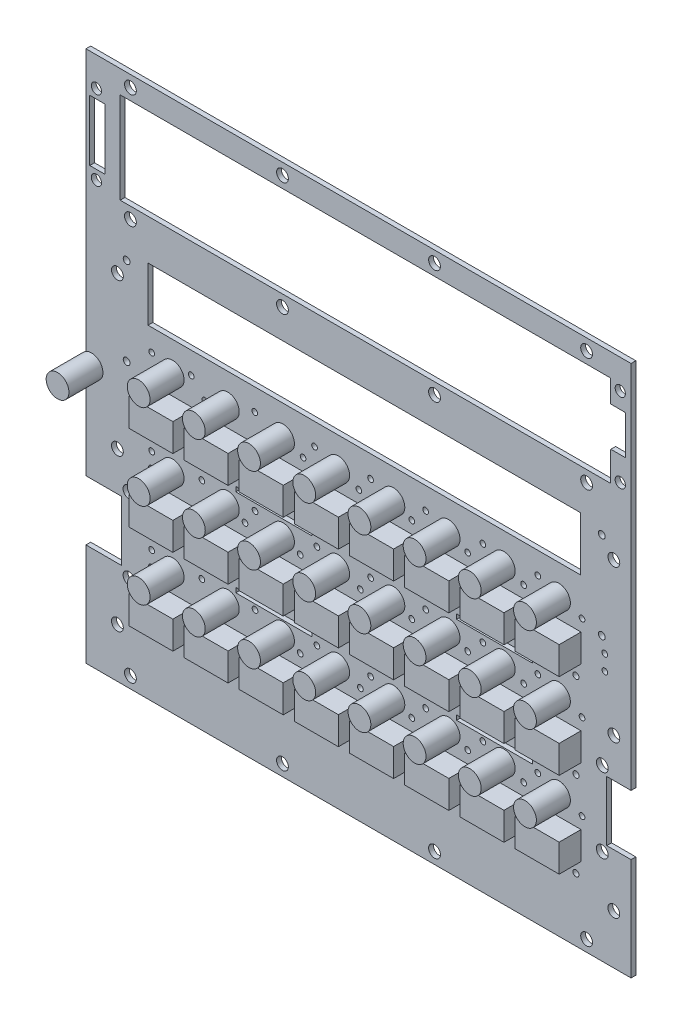
from build123d import *

# Parameters (mm, degrees)
SKETCH1_W                       = 144.56156
SKETCH1_H                       = 18.00098
SKETCH1_W_2                     = 5.08
SKETCH1_H_2                     = 20.32
SKETCH1_W_3                     = 25.4
SKETCH1_H_3                     = 1.5875
BOARD_DEPTH                     = 1.592072
SKETCH2_R                       = 3.81
LED_KINGBRIGHT_3P_2P54_1_DEPTH  = 11.3538
SKETCH3_R                       = 3.81
LED_KINGBRIGHT_3P_2P54_2_DEPTH  = 11.3538
SKETCH4_R                       = 3.81
LED_KINGBRIGHT_3P_2P54_3_DEPTH  = 11.3538
SKETCH5_R                       = 3.81
LED_KINGBRIGHT_3P_2P54_4_DEPTH  = 11.3538
SKETCH6_R                       = 3.81
LED_KINGBRIGHT_3P_2P54_5_DEPTH  = 11.3538
SKETCH7_R                       = 3.81
LED_KINGBRIGHT_3P_2P54_6_DEPTH  = 11.3538
SKETCH8_R                       = 3.81
LED_KINGBRIGHT_3P_2P54_7_DEPTH  = 11.3538
SKETCH9_R                       = 3.81
LED_KINGBRIGHT_3P_2P54_8_DEPTH  = 11.3538
SKETCH10_R                      = 3.81
LED_KINGBRIGHT_3P_2P54_9_DEPTH  = 11.3538
SKETCH11_R                      = 3.81
LED_KINGBRIGHT_3P_2P54_10_DEPTH = 11.3538
SKETCH12_R                      = 3.81
LED_KINGBRIGHT_3P_2P54_11_DEPTH = 11.3538
SKETCH13_R                      = 3.81
LED_KINGBRIGHT_3P_2P54_12_DEPTH = 11.3538
SKETCH14_R                      = 3.81
LED_KINGBRIGHT_3P_2P54_13_DEPTH = 11.3538
SKETCH15_R                      = 3.81
LED_KINGBRIGHT_3P_2P54_14_DEPTH = 11.3538
SKETCH16_R                      = 3.81
LED_KINGBRIGHT_3P_2P54_15_DEPTH = 11.3538
SKETCH17_R                      = 3.81
LED_KINGBRIGHT_3P_2P54_16_DEPTH = 11.3538
SKETCH18_R                      = 3.81
LED_KINGBRIGHT_3P_2P54_17_DEPTH = 11.3538
SKETCH19_R                      = 3.81
LED_KINGBRIGHT_3P_2P54_18_DEPTH = 11.3538
SKETCH20_R                      = 3.81
LED_KINGBRIGHT_3P_2P54_19_DEPTH = 11.3538
SKETCH21_R                      = 3.81
LED_KINGBRIGHT_3P_2P54_20_DEPTH = 11.3538
SKETCH22_R                      = 3.81
LED_KINGBRIGHT_3P_2P54_21_DEPTH = 11.3538
SKETCH23_R                      = 3.81
LED_KINGBRIGHT_3P_2P54_22_DEPTH = 11.3538
SKETCH24_R                      = 3.81
LED_KINGBRIGHT_3P_2P54_23_DEPTH = 11.3538
SKETCH25_R                      = 3.81
LED_KINGBRIGHT_3P_2P54_24_DEPTH = 11.3538
SKETCH26_R                      = 3.81
LED_KINGBRIGHT_3P_2P54_25_DEPTH = 11.3538
SKETCH27_W                      = 14.732
SKETCH27_H                      = 9.271
SWITCH_MCDTS2_1_DEPTH           = 7.3000108
SKETCH28_W                      = 14.732
SKETCH28_H                      = 9.271
SWITCH_MCDTS2_2_DEPTH           = 7.3000108
SKETCH29_W                      = 14.732
SKETCH29_H                      = 9.271
SWITCH_MCDTS2_3_DEPTH           = 7.3000108
SKETCH30_W                      = 14.732
SKETCH30_H                      = 9.271
SWITCH_MCDTS2_4_DEPTH           = 7.3000108
SKETCH31_W                      = 14.732
SKETCH31_H                      = 9.271
SWITCH_MCDTS2_5_DEPTH           = 7.3000108
SKETCH32_W                      = 14.732
SKETCH32_H                      = 9.271
SWITCH_MCDTS2_6_DEPTH           = 7.3000108
SKETCH33_W                      = 14.732
SKETCH33_H                      = 9.271
SWITCH_MCDTS2_7_DEPTH           = 7.3000108
SKETCH34_W                      = 14.732
SKETCH34_H                      = 9.271
SWITCH_MCDTS2_8_DEPTH           = 7.3000108
SKETCH35_W                      = 14.732
SKETCH35_H                      = 9.271
SWITCH_MCDTS2_9_DEPTH           = 7.3000108
SKETCH36_W                      = 14.732
SKETCH36_H                      = 9.271
SWITCH_MCDTS2_10_DEPTH          = 7.3000108
SKETCH37_W                      = 14.732
SKETCH37_H                      = 9.271
SWITCH_MCDTS2_11_DEPTH          = 7.3000108
SKETCH38_W                      = 14.732
SKETCH38_H                      = 9.271
SWITCH_MCDTS2_12_DEPTH          = 7.3000108
SKETCH39_W                      = 14.732
SKETCH39_H                      = 9.271
SWITCH_MCDTS2_13_DEPTH          = 7.3000108
SKETCH40_W                      = 14.732
SKETCH40_H                      = 9.271
SWITCH_MCDTS2_14_DEPTH          = 7.3000108
SKETCH41_W                      = 14.732
SKETCH41_H                      = 9.271
SWITCH_MCDTS2_15_DEPTH          = 7.3000108
SKETCH42_W                      = 14.732
SKETCH42_H                      = 9.271
SWITCH_MCDTS2_16_DEPTH          = 7.3000108
SKETCH43_W                      = 14.732
SKETCH43_H                      = 9.271
SWITCH_MCDTS2_17_DEPTH          = 7.3000108
SKETCH44_W                      = 14.732
SKETCH44_H                      = 9.271
SWITCH_MCDTS2_18_DEPTH          = 7.3000108
SKETCH45_W                      = 14.732
SKETCH45_H                      = 9.271
SWITCH_MCDTS2_19_DEPTH          = 7.3000108
SKETCH46_W                      = 14.732
SKETCH46_H                      = 9.271
SWITCH_MCDTS2_20_DEPTH          = 7.3000108
SKETCH47_W                      = 14.732
SKETCH47_H                      = 9.271
SWITCH_MCDTS2_21_DEPTH          = 7.3000108
SKETCH48_W                      = 14.732
SKETCH48_H                      = 9.271
SWITCH_MCDTS2_22_DEPTH          = 7.3000108
SKETCH49_W                      = 14.732
SKETCH49_H                      = 9.271
SWITCH_MCDTS2_23_DEPTH          = 7.3000108
SKETCH50_W                      = 14.732
SKETCH50_H                      = 9.271
SWITCH_MCDTS2_24_DEPTH          = 7.3000108
SKETCH56_R                      = 1.016
SKETCH56_R_2                    = 0.9652
SKETCH56_R_3                    = 0.9525
SKETCH56_R_4                    = 1.9685
SKETCH56_R_5                    = 1.1303
SKETCH56_R_6                    = 1.7145
CUT_EXTRUDE1_DEPTH              = 10


with BuildPart() as part:
    # Sketch1 → BOARD (new body)
    with BuildSketch(Plane.XY):
        Polygon((0, 0), (182.118, 0), (182.118, 34.24682), (173.98746, 34.24682), (173.98746, 54.24678), (182.118, 54.24678), (182.118, 177.8), (0, 177.8), (0, 54.24678), (11.86942, 54.24678), (11.86942, 34.24682), (0, 34.24682), align=None)
        with Locations((93.01988, 117.17909)):
            Rectangle(SKETCH1_W, SKETCH1_H, mode=Mode.SUBTRACT)
        with Locations((3.81, 154.813)):
            Rectangle(SKETCH1_W_2, SKETCH1_H_2, mode=Mode.SUBTRACT)
        Polygon((12.7, 170.18), (175.26, 170.18), (175.26, 162.6616), (180.086, 162.6616), (180.2892, 162.4584), (180.2892, 149.606), (175.3616, 149.606), (175.26, 149.5044), (175.26, 139.7), (12.7, 139.7), (11.43, 139.7), (11.43, 170.18), align=None, mode=Mode.SUBTRACT)
        with Locations((62.7634, 46.20895)):
            Rectangle(SKETCH1_W_3, SKETCH1_H_3, mode=Mode.SUBTRACT)
        with Locations((136.5134176, 46.20895)):
            Rectangle(SKETCH1_W_3, SKETCH1_H_3, mode=Mode.SUBTRACT)
        with Locations((136.5134176, 75.41895)):
            Rectangle(SKETCH1_W_3, SKETCH1_H_3, mode=Mode.SUBTRACT)
        with Locations((62.7634, 75.41895)):
            Rectangle(SKETCH1_W_3, SKETCH1_H_3, mode=Mode.SUBTRACT)
    extrude(amount=BOARD_DEPTH)

    # Sketch56 → Cut-Extrude1 (cut)
    with BuildSketch(Plane.XY.offset(1.592072)):
        with Locations((163.703, 21.1074)):
            Circle(SKETCH56_R)
        with Locations((163.703, 49.6824)):
            Circle(SKETCH56_R)
        with Locations((145.2626, 21.8186)):
            Circle(SKETCH56_R_2)
        with Locations((126.8476, 21.6154)):
            Circle(SKETCH56_R_2)
        with Locations((108.4072, 21.7424)):
            Circle(SKETCH56_R_2)
        with Locations((89.9668, 21.844)):
            Circle(SKETCH56_R_2)
        with Locations((71.5264, 20.7772)):
            Circle(SKETCH56_R_2)
        with Locations((53.086, 21.1582)):
            Circle(SKETCH56_R_2)
        with Locations((34.6472002, 21.1328)):
            Circle(SKETCH56_R)
        with Locations((145.2626, 49.5554)):
            Circle(SKETCH56_R)
        with Locations((126.8222, 49.3522)):
            Circle(SKETCH56_R)
        with Locations((108.3818, 49.1236)):
            Circle(SKETCH56_R)
        with Locations((89.9414, 49.6824)):
            Circle(SKETCH56_R)
        with Locations((71.501, 49.1998)):
            Circle(SKETCH56_R)
        with Locations((53.0606, 49.1998)):
            Circle(SKETCH56_R)
        with Locations((34.6202, 49.276)):
            Circle(SKETCH56_R)
        with Locations((163.703, 78.2574)):
            Circle(SKETCH56_R)
        with Locations((145.2626, 77.7748)):
            Circle(SKETCH56_R)
        with Locations((126.746, 78.3336)):
            Circle(SKETCH56_R)
        with Locations((108.3818, 78.74)):
            Circle(SKETCH56_R)
        with Locations((89.9414, 78.3336)):
            Circle(SKETCH56_R)
        with Locations((71.501, 78.2574)):
            Circle(SKETCH56_R)
        with Locations((53.0606, 78.4098)):
            Circle(SKETCH56_R)
        with Locations((34.6202, 78.0542)):
            Circle(SKETCH56_R)
        with Locations((91.694, 38.6588)):
            Circle(SKETCH56_R_3)
        with Locations((77.1652, 43.7388)):
            Circle(SKETCH56_R_3)
        with Locations((71.5772, 38.6588)):
            Circle(SKETCH56_R_3)
        with Locations((56.4896, 43.7388)):
            Circle(SKETCH56_R_3)
        with Locations((38.735, 43.7388)):
            Circle(SKETCH56_R_3)
        with Locations((21.8948, 38.6588)):
            Circle(SKETCH56_R_3)
        with Locations((21.971, 43.7388)):
            Circle(SKETCH56_R_3)
        with Locations((77.1652, 72.3138)):
            Circle(SKETCH56_R_3)
        with Locations((91.694, 67.2338)):
            Circle(SKETCH56_R_3)
        with Locations((71.5772, 67.2338)):
            Circle(SKETCH56_R_3)
        with Locations((56.4896, 72.3138)):
            Circle(SKETCH56_R_3)
        with Locations((53.1368, 67.2338)):
            Circle(SKETCH56_R_3)
        with Locations((38.735, 72.3138)):
            Circle(SKETCH56_R_3)
        with Locations((21.8948, 67.2338)):
            Circle(SKETCH56_R_3)
        with Locations((21.971, 72.3138)):
            Circle(SKETCH56_R_3)
        with Locations((165.735, 95.8088)):
            Circle(SKETCH56_R_3)
        with Locations((150.9776, 100.8888)):
            Circle(SKETCH56_R_3)
        with Locations((146.2278, 95.8088)):
            Circle(SKETCH56_R_3)
        with Locations((132.6134, 100.8888)):
            Circle(SKETCH56_R_3)
        with Locations((113.4872, 100.8888)):
            Circle(SKETCH56_R_3)
        with Locations((127.508, 95.8088)):
            Circle(SKETCH56_R_3)
        with Locations((108.8644, 95.8088)):
            Circle(SKETCH56_R_3)
        with Locations((95.0976, 100.8888)):
            Circle(SKETCH56_R_3)
        with Locations((91.186, 95.8088)):
            Circle(SKETCH56_R_3)
        with Locations((76.3778, 100.8888)):
            Circle(SKETCH56_R_3)
        with Locations((72.5424, 95.8088)):
            Circle(SKETCH56_R_3)
        with Locations((56.4134, 100.8888)):
            Circle(SKETCH56_R_3)
        with Locations((39.7256, 95.8088)):
            Circle(SKETCH56_R_3)
        with Locations((35.179, 100.8888)):
            Circle(SKETCH56_R_3)
        with Locations((24.2062, 95.8088)):
            Circle(SKETCH56_R_3)
        with Locations((21.971, 100.8888)):
            Circle(SKETCH56_R_3)
        with Locations((132.6134, 72.3138)):
            Circle(SKETCH56_R_3)
        with Locations((146.2278, 67.2338)):
            Circle(SKETCH56_R_3)
        with Locations((113.4872, 72.3138)):
            Circle(SKETCH56_R_3)
        with Locations((127.508, 67.2338)):
            Circle(SKETCH56_R_3)
        with Locations((95.0976, 72.3138)):
            Circle(SKETCH56_R_3)
        with Locations((108.8644, 67.2338)):
            Circle(SKETCH56_R_3)
        with Locations((150.9776, 43.7388)):
            Circle(SKETCH56_R_3)
        with Locations((132.6134, 43.7388)):
            Circle(SKETCH56_R_3)
        with Locations((113.4872, 43.7388)):
            Circle(SKETCH56_R_3)
        with Locations((95.0976, 43.7388)):
            Circle(SKETCH56_R_3)
        with Locations((108.8644, 38.6588)):
            Circle(SKETCH56_R_3)
        with Locations((150.9776, 72.3138)):
            Circle(SKETCH56_R_3)
        with Locations((165.735, 67.2338)):
            Circle(SKETCH56_R_3)
        with Locations((173.3296, 89.4588)):
            Circle(SKETCH56_R_3)
        with Locations((173.355, 84.3534)):
            Circle(SKETCH56_R_3)
        with Locations((176.37252, 118.11)):
            Circle(SKETCH56_R_4)
        with Locations((176.37252, 67.31)):
            Circle(SKETCH56_R_4)
        with Locations((176.37252, 16.51)):
            Circle(SKETCH56_R_4)
        with Locations((167.259, 135.89)):
            Circle(SKETCH56_R_4)
        with Locations((116.459, 135.89)):
            Circle(SKETCH56_R_4)
        with Locations((65.659, 135.89)):
            Circle(SKETCH56_R_4)
        with Locations((14.859, 135.89)):
            Circle(SKETCH56_R_4)
        with Locations((10.51052, 118.11)):
            Circle(SKETCH56_R_4)
        with Locations((10.51052, 67.31)):
            Circle(SKETCH56_R_4)
        with Locations((10.51052, 16.51)):
            Circle(SKETCH56_R_4)
        with Locations((165.735, 38.6588)):
            Circle(SKETCH56_R_3)
        with Locations((146.2278, 38.6588)):
            Circle(SKETCH56_R_3)
        with Locations((127.508, 38.6588)):
            Circle(SKETCH56_R_3)
        with Locations((14.859, 173.99)):
            Circle(SKETCH56_R_4)
        with Locations((65.659, 173.99)):
            Circle(SKETCH56_R_4)
        with Locations((116.459, 173.99)):
            Circle(SKETCH56_R_4)
        with Locations((167.259, 173.99)):
            Circle(SKETCH56_R_4)
        with Locations((167.259, 3.81)):
            Circle(SKETCH56_R_4)
        with Locations((116.459, 3.81)):
            Circle(SKETCH56_R_4)
        with Locations((65.659, 3.81)):
            Circle(SKETCH56_R_4)
        with Locations((14.859, 3.81)):
            Circle(SKETCH56_R_4)
        with Locations((172.50664, 56.7436)):
            Circle(SKETCH56_R_4)
        with Locations((172.50664, 31.75)):
            Circle(SKETCH56_R_4)
        with Locations((14.36878, 56.7436)):
            Circle(SKETCH56_R_4)
        with Locations((14.36878, 31.75)):
            Circle(SKETCH56_R_4)
        with Locations((172.34154, 123.37542)):
            Circle(SKETCH56_R_5)
        with Locations((172.34154, 94.16542)):
            Circle(SKETCH56_R_5)
        with Locations((13.59154, 94.16542)):
            Circle(SKETCH56_R_5)
        with Locations((13.59154, 123.37542)):
            Circle(SKETCH56_R_5)
        with Locations((178.51374, 141.56182)):
            Circle(SKETCH56_R_6)
        with Locations((178.51374, 168.06164)):
            Circle(SKETCH56_R_6)
        with Locations((3.50012, 168.06164)):
            Circle(SKETCH56_R_6)
        with Locations((3.50012, 141.56182)):
            Circle(SKETCH56_R_6)
    extrude(amount=-CUT_EXTRUDE1_DEPTH, mode=Mode.SUBTRACT)


with BuildPart() as body_2:
    # Sketch2 → LED-KINGBRIGHT_3P_2P54-1 (new body)
    with BuildSketch(Plane.XY.offset(1.592072)):
        with Locations((1.86944, 86.9188)):
            Circle(SKETCH2_R)
    extrude(amount=LED_KINGBRIGHT_3P_2P54_1_DEPTH)


with BuildPart() as body_3:
    # Sketch3 → LED-KINGBRIGHT_3P_2P54-2 (new body)
    with BuildSketch(Plane.XY.offset(1.592072)):
        with Locations((158.0312054, 41.1988)):
            Circle(SKETCH3_R)
    extrude(amount=LED_KINGBRIGHT_3P_2P54_2_DEPTH)


with BuildPart() as body_4:
    # Sketch4 → LED-KINGBRIGHT_3P_2P54-3 (new body)
    with BuildSketch(Plane.XY.offset(1.592072)):
        with Locations((139.593701, 41.1988)):
            Circle(SKETCH4_R)
    extrude(amount=LED_KINGBRIGHT_3P_2P54_3_DEPTH)


with BuildPart() as body_5:
    # Sketch5 → LED-KINGBRIGHT_3P_2P54-4 (new body)
    with BuildSketch(Plane.XY.offset(1.592072)):
        with Locations((121.1561966, 41.1988)):
            Circle(SKETCH5_R)
    extrude(amount=LED_KINGBRIGHT_3P_2P54_4_DEPTH)


with BuildPart() as body_6:
    # Sketch6 → LED-KINGBRIGHT_3P_2P54-5 (new body)
    with BuildSketch(Plane.XY.offset(1.592072)):
        with Locations((102.7187176, 41.1988)):
            Circle(SKETCH6_R)
    extrude(amount=LED_KINGBRIGHT_3P_2P54_5_DEPTH)


with BuildPart() as body_7:
    # Sketch7 → LED-KINGBRIGHT_3P_2P54-6 (new body)
    with BuildSketch(Plane.XY.offset(1.592072)):
        with Locations((158.0312308, 69.7738)):
            Circle(SKETCH7_R)
    extrude(amount=LED_KINGBRIGHT_3P_2P54_6_DEPTH)


with BuildPart() as body_8:
    # Sketch8 → LED-KINGBRIGHT_3P_2P54-7 (new body)
    with BuildSketch(Plane.XY.offset(1.592072)):
        with Locations((139.5937264, 69.7738)):
            Circle(SKETCH8_R)
    extrude(amount=LED_KINGBRIGHT_3P_2P54_7_DEPTH)


with BuildPart() as body_9:
    # Sketch9 → LED-KINGBRIGHT_3P_2P54-8 (new body)
    with BuildSketch(Plane.XY.offset(1.592072)):
        with Locations((121.156222, 69.7738)):
            Circle(SKETCH9_R)
    extrude(amount=LED_KINGBRIGHT_3P_2P54_8_DEPTH)


with BuildPart() as body_10:
    # Sketch10 → LED-KINGBRIGHT_3P_2P54-9 (new body)
    with BuildSketch(Plane.XY.offset(1.592072)):
        with Locations((102.7187176, 69.7738)):
            Circle(SKETCH10_R)
    extrude(amount=LED_KINGBRIGHT_3P_2P54_9_DEPTH)


with BuildPart() as body_11:
    # Sketch11 → LED-KINGBRIGHT_3P_2P54-10 (new body)
    with BuildSketch(Plane.XY.offset(1.592072)):
        with Locations((84.2812132, 41.1988)):
            Circle(SKETCH11_R)
    extrude(amount=LED_KINGBRIGHT_3P_2P54_10_DEPTH)


with BuildPart() as body_12:
    # Sketch12 → LED-KINGBRIGHT_3P_2P54-11 (new body)
    with BuildSketch(Plane.XY.offset(1.592072)):
        with Locations((65.8437088, 41.1988)):
            Circle(SKETCH12_R)
    extrude(amount=LED_KINGBRIGHT_3P_2P54_11_DEPTH)


with BuildPart() as body_13:
    # Sketch13 → LED-KINGBRIGHT_3P_2P54-12 (new body)
    with BuildSketch(Plane.XY.offset(1.592072)):
        with Locations((47.4062044, 41.1988)):
            Circle(SKETCH13_R)
    extrude(amount=LED_KINGBRIGHT_3P_2P54_12_DEPTH)


with BuildPart() as body_14:
    # Sketch14 → LED-KINGBRIGHT_3P_2P54-13 (new body)
    with BuildSketch(Plane.XY.offset(1.592072)):
        with Locations((28.9687, 41.1988)):
            Circle(SKETCH14_R)
    extrude(amount=LED_KINGBRIGHT_3P_2P54_13_DEPTH)


with BuildPart() as body_15:
    # Sketch15 → LED-KINGBRIGHT_3P_2P54-14 (new body)
    with BuildSketch(Plane.XY.offset(1.592072)):
        with Locations((84.2812132, 69.7738)):
            Circle(SKETCH15_R)
    extrude(amount=LED_KINGBRIGHT_3P_2P54_14_DEPTH)


with BuildPart() as body_16:
    # Sketch16 → LED-KINGBRIGHT_3P_2P54-15 (new body)
    with BuildSketch(Plane.XY.offset(1.592072)):
        with Locations((65.8437088, 69.7738)):
            Circle(SKETCH16_R)
    extrude(amount=LED_KINGBRIGHT_3P_2P54_15_DEPTH)


with BuildPart() as body_17:
    # Sketch17 → LED-KINGBRIGHT_3P_2P54-16 (new body)
    with BuildSketch(Plane.XY.offset(1.592072)):
        with Locations((47.4062044, 69.7738)):
            Circle(SKETCH17_R)
    extrude(amount=LED_KINGBRIGHT_3P_2P54_16_DEPTH)


with BuildPart() as body_18:
    # Sketch18 → LED-KINGBRIGHT_3P_2P54-17 (new body)
    with BuildSketch(Plane.XY.offset(1.592072)):
        with Locations((28.9687, 69.7738)):
            Circle(SKETCH18_R)
    extrude(amount=LED_KINGBRIGHT_3P_2P54_17_DEPTH)


with BuildPart() as body_19:
    # Sketch19 → LED-KINGBRIGHT_3P_2P54-18 (new body)
    with BuildSketch(Plane.XY.offset(1.592072)):
        with Locations((158.0312308, 98.3488)):
            Circle(SKETCH19_R)
    extrude(amount=LED_KINGBRIGHT_3P_2P54_18_DEPTH)


with BuildPart() as body_20:
    # Sketch20 → LED-KINGBRIGHT_3P_2P54-19 (new body)
    with BuildSketch(Plane.XY.offset(1.592072)):
        with Locations((139.5937264, 98.3488)):
            Circle(SKETCH20_R)
    extrude(amount=LED_KINGBRIGHT_3P_2P54_19_DEPTH)


with BuildPart() as body_21:
    # Sketch21 → LED-KINGBRIGHT_3P_2P54-20 (new body)
    with BuildSketch(Plane.XY.offset(1.592072)):
        with Locations((121.156222, 98.3488)):
            Circle(SKETCH21_R)
    extrude(amount=LED_KINGBRIGHT_3P_2P54_20_DEPTH)


with BuildPart() as body_22:
    # Sketch22 → LED-KINGBRIGHT_3P_2P54-21 (new body)
    with BuildSketch(Plane.XY.offset(1.592072)):
        with Locations((102.7187176, 98.3488)):
            Circle(SKETCH22_R)
    extrude(amount=LED_KINGBRIGHT_3P_2P54_21_DEPTH)


with BuildPart() as body_23:
    # Sketch23 → LED-KINGBRIGHT_3P_2P54-22 (new body)
    with BuildSketch(Plane.XY.offset(1.592072)):
        with Locations((84.2812132, 98.3488)):
            Circle(SKETCH23_R)
    extrude(amount=LED_KINGBRIGHT_3P_2P54_22_DEPTH)


with BuildPart() as body_24:
    # Sketch24 → LED-KINGBRIGHT_3P_2P54-23 (new body)
    with BuildSketch(Plane.XY.offset(1.592072)):
        with Locations((65.8437088, 98.3488)):
            Circle(SKETCH24_R)
    extrude(amount=LED_KINGBRIGHT_3P_2P54_23_DEPTH)


with BuildPart() as body_25:
    # Sketch25 → LED-KINGBRIGHT_3P_2P54-24 (new body)
    with BuildSketch(Plane.XY.offset(1.592072)):
        with Locations((47.4062044, 98.3488)):
            Circle(SKETCH25_R)
    extrude(amount=LED_KINGBRIGHT_3P_2P54_24_DEPTH)


with BuildPart() as body_26:
    # Sketch26 → LED-KINGBRIGHT_3P_2P54-25 (new body)
    with BuildSketch(Plane.XY.offset(1.592072)):
        with Locations((28.9687, 98.3488)):
            Circle(SKETCH26_R)
    extrude(amount=LED_KINGBRIGHT_3P_2P54_25_DEPTH)


with BuildPart() as body_27:
    # Sketch27 → SWITCH-MCDTS2-1 (new body)
    with BuildSketch(Plane.XY.offset(1.592072)):
        with Locations((158.0312308, 29.9593)):
            Rectangle(SKETCH27_W, SKETCH27_H)
    extrude(amount=SWITCH_MCDTS2_1_DEPTH)


with BuildPart() as body_28:
    # Sketch28 → SWITCH-MCDTS2-2 (new body)
    with BuildSketch(Plane.XY.offset(1.592072)):
        with Locations((158.0312308, 58.5343)):
            Rectangle(SKETCH28_W, SKETCH28_H)
    extrude(amount=SWITCH_MCDTS2_2_DEPTH)


with BuildPart() as body_29:
    # Sketch29 → SWITCH-MCDTS2-3 (new body)
    with BuildSketch(Plane.XY.offset(1.592072)):
        with Locations((139.5937264, 29.9593)):
            Rectangle(SKETCH29_W, SKETCH29_H)
    extrude(amount=SWITCH_MCDTS2_3_DEPTH)


with BuildPart() as body_30:
    # Sketch30 → SWITCH-MCDTS2-4 (new body)
    with BuildSketch(Plane.XY.offset(1.592072)):
        with Locations((121.156222, 29.9593)):
            Rectangle(SKETCH30_W, SKETCH30_H)
    extrude(amount=SWITCH_MCDTS2_4_DEPTH)


with BuildPart() as body_31:
    # Sketch31 → SWITCH-MCDTS2-5 (new body)
    with BuildSketch(Plane.XY.offset(1.592072)):
        with Locations((102.7187176, 29.9593)):
            Rectangle(SKETCH31_W, SKETCH31_H)
    extrude(amount=SWITCH_MCDTS2_5_DEPTH)


with BuildPart() as body_32:
    # Sketch32 → SWITCH-MCDTS2-6 (new body)
    with BuildSketch(Plane.XY.offset(1.592072)):
        with Locations((84.2812132, 29.9593)):
            Rectangle(SKETCH32_W, SKETCH32_H)
    extrude(amount=SWITCH_MCDTS2_6_DEPTH)


with BuildPart() as body_33:
    # Sketch33 → SWITCH-MCDTS2-7 (new body)
    with BuildSketch(Plane.XY.offset(1.592072)):
        with Locations((65.8437088, 29.9593)):
            Rectangle(SKETCH33_W, SKETCH33_H)
    extrude(amount=SWITCH_MCDTS2_7_DEPTH)


with BuildPart() as body_34:
    # Sketch34 → SWITCH-MCDTS2-8 (new body)
    with BuildSketch(Plane.XY.offset(1.592072)):
        with Locations((47.4062044, 29.9593)):
            Rectangle(SKETCH34_W, SKETCH34_H)
    extrude(amount=SWITCH_MCDTS2_8_DEPTH)


with BuildPart() as body_35:
    # Sketch35 → SWITCH-MCDTS2-9 (new body)
    with BuildSketch(Plane.XY.offset(1.592072)):
        with Locations((28.9687, 29.9593)):
            Rectangle(SKETCH35_W, SKETCH35_H)
    extrude(amount=SWITCH_MCDTS2_9_DEPTH)


with BuildPart() as body_36:
    # Sketch36 → SWITCH-MCDTS2-10 (new body)
    with BuildSketch(Plane.XY.offset(1.592072)):
        with Locations((139.5937264, 58.5343)):
            Rectangle(SKETCH36_W, SKETCH36_H)
    extrude(amount=SWITCH_MCDTS2_10_DEPTH)


with BuildPart() as body_37:
    # Sketch37 → SWITCH-MCDTS2-11 (new body)
    with BuildSketch(Plane.XY.offset(1.592072)):
        with Locations((121.156222, 58.5343)):
            Rectangle(SKETCH37_W, SKETCH37_H)
    extrude(amount=SWITCH_MCDTS2_11_DEPTH)


with BuildPart() as body_38:
    # Sketch38 → SWITCH-MCDTS2-12 (new body)
    with BuildSketch(Plane.XY.offset(1.592072)):
        with Locations((102.7187176, 58.5343)):
            Rectangle(SKETCH38_W, SKETCH38_H)
    extrude(amount=SWITCH_MCDTS2_12_DEPTH)


with BuildPart() as body_39:
    # Sketch39 → SWITCH-MCDTS2-13 (new body)
    with BuildSketch(Plane.XY.offset(1.592072)):
        with Locations((84.2812132, 58.5343)):
            Rectangle(SKETCH39_W, SKETCH39_H)
    extrude(amount=SWITCH_MCDTS2_13_DEPTH)


with BuildPart() as body_40:
    # Sketch40 → SWITCH-MCDTS2-14 (new body)
    with BuildSketch(Plane.XY.offset(1.592072)):
        with Locations((65.8437088, 58.5343)):
            Rectangle(SKETCH40_W, SKETCH40_H)
    extrude(amount=SWITCH_MCDTS2_14_DEPTH)


with BuildPart() as body_41:
    # Sketch41 → SWITCH-MCDTS2-15 (new body)
    with BuildSketch(Plane.XY.offset(1.592072)):
        with Locations((47.4062044, 58.5343)):
            Rectangle(SKETCH41_W, SKETCH41_H)
    extrude(amount=SWITCH_MCDTS2_15_DEPTH)


with BuildPart() as body_42:
    # Sketch42 → SWITCH-MCDTS2-16 (new body)
    with BuildSketch(Plane.XY.offset(1.592072)):
        with Locations((28.9687, 58.5343)):
            Rectangle(SKETCH42_W, SKETCH42_H)
    extrude(amount=SWITCH_MCDTS2_16_DEPTH)


with BuildPart() as body_43:
    # Sketch43 → SWITCH-MCDTS2-17 (new body)
    with BuildSketch(Plane.XY.offset(1.592072)):
        with Locations((158.0312308, 87.1093)):
            Rectangle(SKETCH43_W, SKETCH43_H)
    extrude(amount=SWITCH_MCDTS2_17_DEPTH)


with BuildPart() as body_44:
    # Sketch44 → SWITCH-MCDTS2-18 (new body)
    with BuildSketch(Plane.XY.offset(1.592072)):
        with Locations((139.5937264, 87.1093)):
            Rectangle(SKETCH44_W, SKETCH44_H)
    extrude(amount=SWITCH_MCDTS2_18_DEPTH)


with BuildPart() as body_45:
    # Sketch45 → SWITCH-MCDTS2-19 (new body)
    with BuildSketch(Plane.XY.offset(1.592072)):
        with Locations((121.156222, 87.1093)):
            Rectangle(SKETCH45_W, SKETCH45_H)
    extrude(amount=SWITCH_MCDTS2_19_DEPTH)


with BuildPart() as body_46:
    # Sketch46 → SWITCH-MCDTS2-20 (new body)
    with BuildSketch(Plane.XY.offset(1.592072)):
        with Locations((102.7187176, 87.1093)):
            Rectangle(SKETCH46_W, SKETCH46_H)
    extrude(amount=SWITCH_MCDTS2_20_DEPTH)


with BuildPart() as body_47:
    # Sketch47 → SWITCH-MCDTS2-21 (new body)
    with BuildSketch(Plane.XY.offset(1.592072)):
        with Locations((84.2812132, 87.1093)):
            Rectangle(SKETCH47_W, SKETCH47_H)
    extrude(amount=SWITCH_MCDTS2_21_DEPTH)


with BuildPart() as body_48:
    # Sketch48 → SWITCH-MCDTS2-22 (new body)
    with BuildSketch(Plane.XY.offset(1.592072)):
        with Locations((65.8437088, 87.1093)):
            Rectangle(SKETCH48_W, SKETCH48_H)
    extrude(amount=SWITCH_MCDTS2_22_DEPTH)


with BuildPart() as body_49:
    # Sketch49 → SWITCH-MCDTS2-23 (new body)
    with BuildSketch(Plane.XY.offset(1.592072)):
        with Locations((47.4062044, 87.1093)):
            Rectangle(SKETCH49_W, SKETCH49_H)
    extrude(amount=SWITCH_MCDTS2_23_DEPTH)


with BuildPart() as body_50:
    # Sketch50 → SWITCH-MCDTS2-24 (new body)
    with BuildSketch(Plane.XY.offset(1.592072)):
        with Locations((28.9687, 87.1093)):
            Rectangle(SKETCH50_W, SKETCH50_H)
    extrude(amount=SWITCH_MCDTS2_24_DEPTH)


solid = Compound([part.part, body_2.part, body_3.part, body_4.part, body_5.part, body_6.part, body_7.part, body_8.part, body_9.part, body_10.part, body_11.part, body_12.part, body_13.part, body_14.part, body_15.part, body_16.part, body_17.part, body_18.part, body_19.part, body_20.part, body_21.part, body_22.part, body_23.part, body_24.part, body_25.part, body_26.part, body_27.part, body_28.part, body_29.part, body_30.part, body_31.part, body_32.part, body_33.part, body_34.part, body_35.part, body_36.part, body_37.part, body_38.part, body_39.part, body_40.part, body_41.part, body_42.part, body_43.part, body_44.part, body_45.part, body_46.part, body_47.part, body_48.part, body_49.part, body_50.part])
